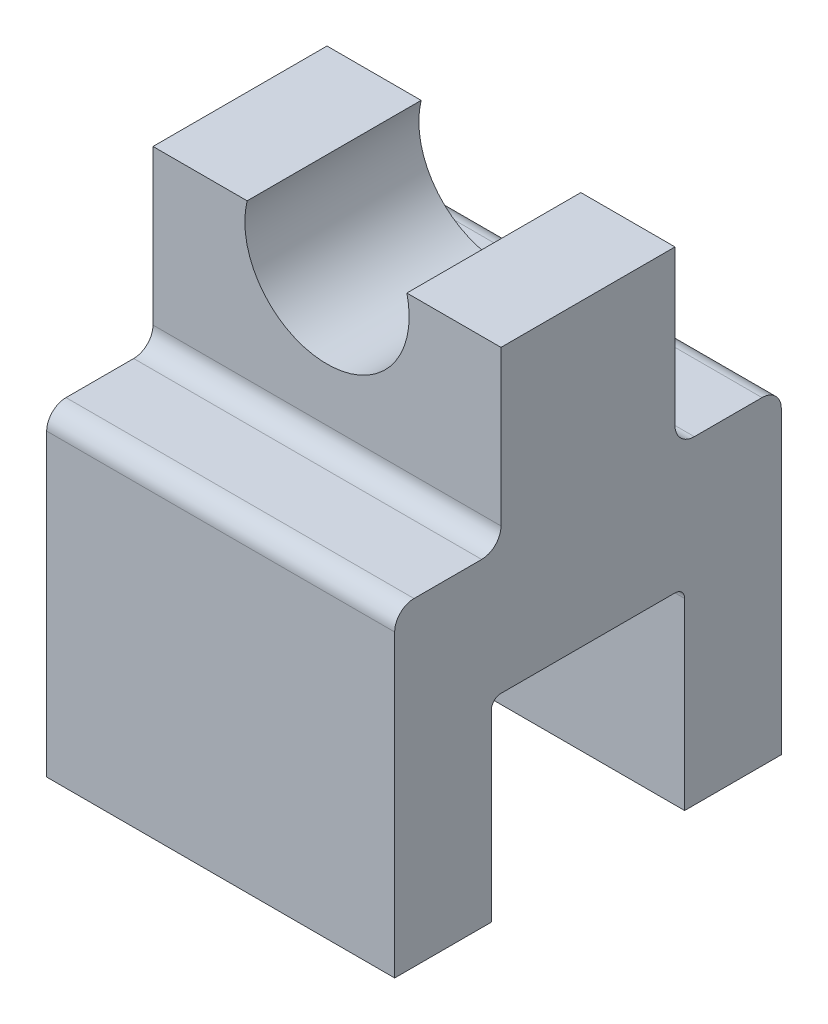
from build123d import *

# Parameters (mm, degrees)
BOSS_EXTRUDE1_DEPTH = 50.8
SKETCH2_W           = 25.4
SKETCH2_H           = 25.4
CUT_EXTRUDE1_DEPTH  = 95.160030268
FILLET1_R           = 1.27
SKETCH4_W           = 13.97
SKETCH4_H           = 22.86
CUT_EXTRUDE2_DEPTH  = 95.160030268
FILLET2_R           = 2.54


with BuildPart() as part:
    # Sketch1 → Boss-Extrude1 (new body)
    with BuildSketch(Plane.XY):
        with BuildLine():
            Line((33.351921893, 64.77), (45.72, 64.77))
            Line((45.72, 64.77), (45.72, 0))
            Line((45.72, 0), (0, 0))
            Line((0, 0), (0, 64.77))
            Line((0, 64.77), (12.368078107, 64.77))
            ThreePointArc((12.368078107, 64.77), (22.86, 51.435), (33.351921893, 64.77))
        make_face()
    extrude(amount=BOSS_EXTRUDE1_DEPTH)

    # Sketch2 → Cut-Extrude1 (cut, through all)
    with BuildSketch(Plane(origin=(45.72, 0, 0), x_dir=(0, 0, -1), z_dir=(1, 0, 0))):
        with Locations((-25.4, 12.7)):
            Rectangle(SKETCH2_W, SKETCH2_H)
    extrude(amount=-CUT_EXTRUDE1_DEPTH, mode=Mode.SUBTRACT)

    # Fillet1
    fillet1_edges = [part.edges().sort_by_distance(p)[0] for p in [
        (22.86, 25.4, 38.1),
        (22.86, 25.4, 12.7),
    ]]
    fillet(fillet1_edges, radius=FILLET1_R)

    # Sketch4 → Cut-Extrude2 (cut, through all)
    with BuildSketch(Plane.ZY):
        with Locations((43.815, 53.34)):
            Rectangle(SKETCH4_W, SKETCH4_H)
        with Locations((6.985, 53.34)):
            Rectangle(SKETCH4_W, SKETCH4_H)
    extrude(amount=-CUT_EXTRUDE2_DEPTH, mode=Mode.SUBTRACT)

    # Fillet2
    fillet2_edges = [part.edges().sort_by_distance(p)[0] for p in [
        (22.86, 41.91, 36.83),
        (22.86, 41.91, 50.8),
        (22.86, 41.91, 0),
        (22.86, 41.91, 13.97),
    ]]
    fillet(fillet2_edges, radius=FILLET2_R)


solid = part.part
